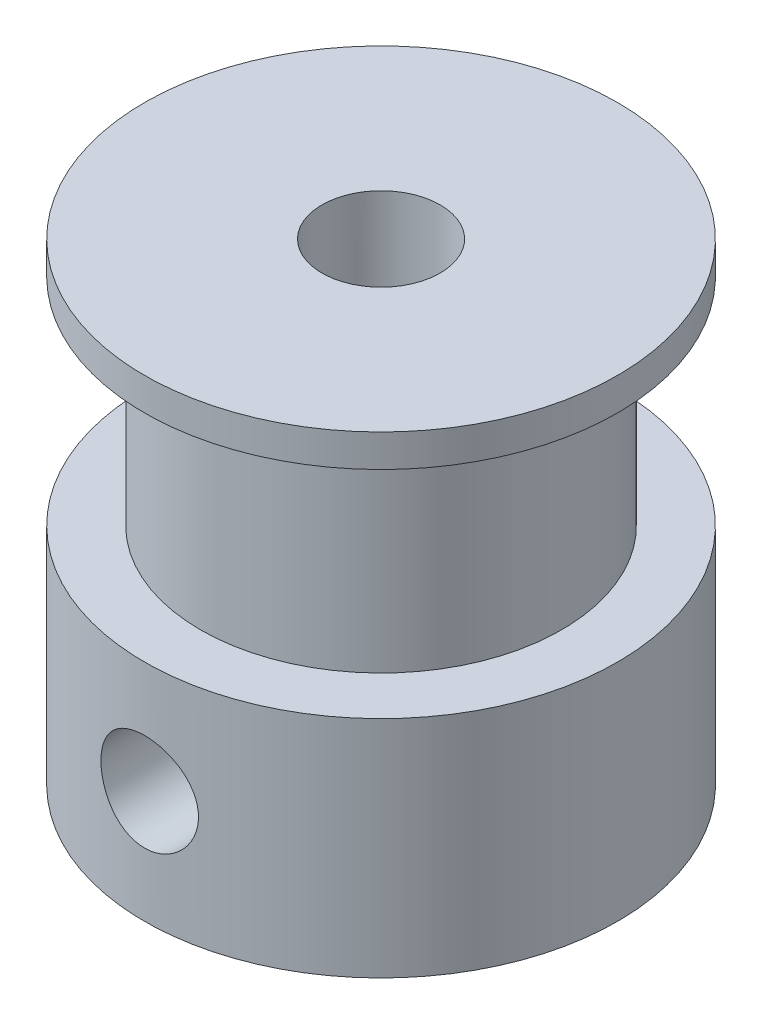
from build123d import *

# Parameters (mm, degrees)
ESQUISSE4_W                  = 1.65
ESQUISSE4_H                  = 8
R_P_TITION_CIRCULAIRE1_COUNT = 2
R_P_TITION_CIRCULAIRE1_ANGLE = 90


with BuildPart() as part:
    # Esquisse2 → Révolution1 (revolve)
    with BuildSketch(Plane.XY):
        Polygon((2, 16), (8, 16), (8, 14.9), (6.11, 14.9), (6.11, 7.6), (8, 7.6), (8, 0), (2, 0), align=None)
    revolve(axis=Axis((0, 0, 0), (0, 1, 0)))

    # Esquisse4 → Trou pour taraudage pour trou taraudé M41 (revolve, cut)
    with BuildSketch(Plane(origin=(0, 3.8, 0), x_dir=(0, 1, 0), z_dir=(1, 0, 0))):
        with Locations((0.825, 4)):
            Rectangle(ESQUISSE4_W, ESQUISSE4_H)
    trou_pour_taraudage_pour_trou_taraud_m4 = revolve(axis=Axis((0, 3.8, -6.35), (0, 0, 1)), mode=Mode.SUBTRACT)

    # Répétition circulaire1: Trou pour taraudage pour trou taraudé M41 ×2 about axis
    r_p_tition_circulaire1_axis = Axis((0, 16, 0), (0, -1, 0))
    for i in range(1, R_P_TITION_CIRCULAIRE1_COUNT):
        add(trou_pour_taraudage_pour_trou_taraud_m4.rotate(r_p_tition_circulaire1_axis, i * R_P_TITION_CIRCULAIRE1_ANGLE / (R_P_TITION_CIRCULAIRE1_COUNT - 1)), mode=Mode.SUBTRACT)


solid = part.part
